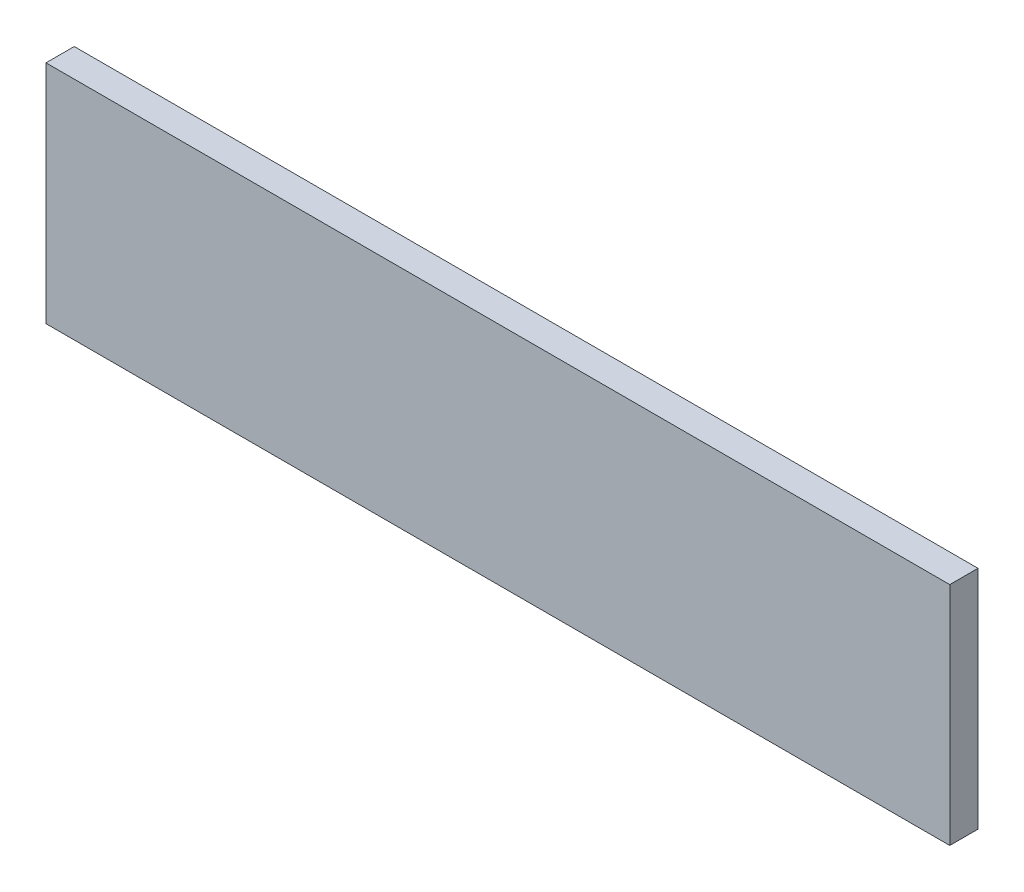
from build123d import *

# Parameters (mm, degrees)
SKETCH1_W           = 101.6
SKETCH1_H           = 25.4
BOSS_EXTRUDE1_DEPTH = 1.5875


with BuildPart() as part:
    # Sketch1 → Boss-Extrude1 (new, symmetric)
    with BuildSketch(Plane.XY):
        Rectangle(SKETCH1_W, SKETCH1_H)
    extrude(amount=BOSS_EXTRUDE1_DEPTH, both=True)


solid = part.part
